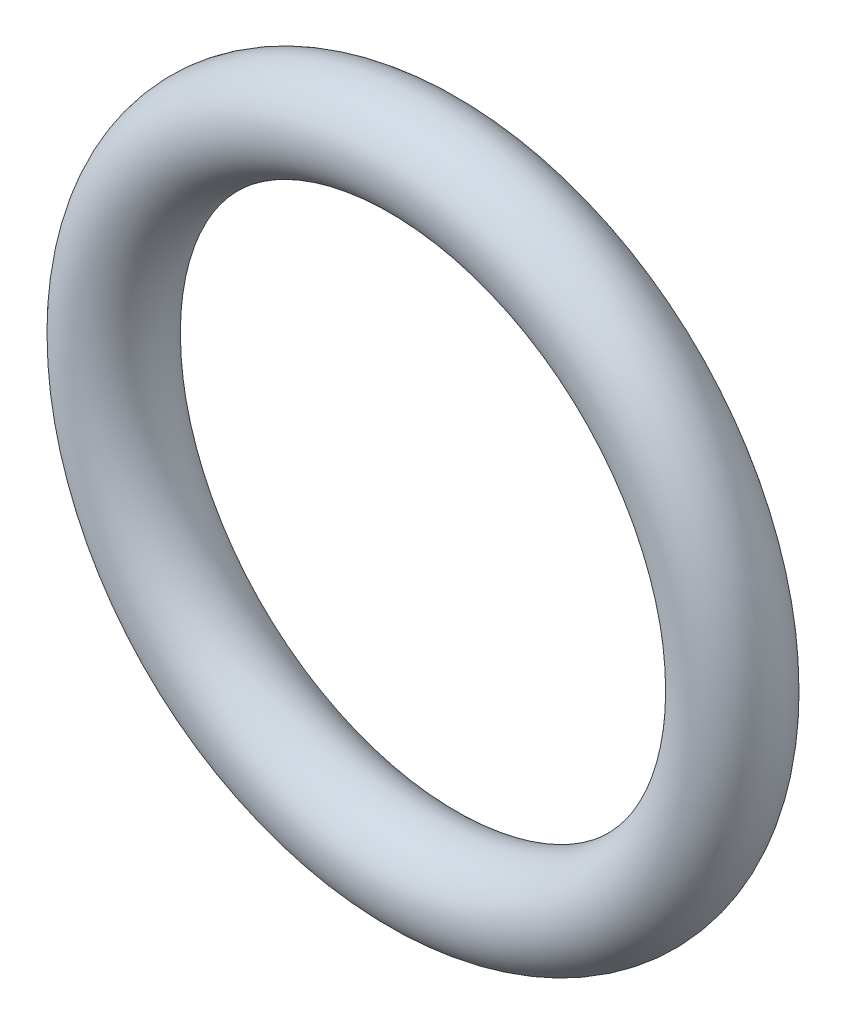
from build123d import *

# Parameters (mm, degrees)
SK_ORING10_R = 0.9


with BuildPart() as part:
    # Sk_oring10 → Rev_oring10 (revolve)
    with BuildSketch(Plane(origin=(0, 0, 0), x_dir=(1, 0, 0), z_dir=(0, 1, 0)), mode=Mode.PRIVATE) as rev_oring10_sk:
        with Locations((5.9, 0)):
            Circle(SK_ORING10_R)
    revolve(rev_oring10_sk.sketch.rotate(Axis((0, 0, 0), (0, 0, 1)), 180), axis=Axis((0, 0, 0), (0, 0, 1)))


solid = part.part
